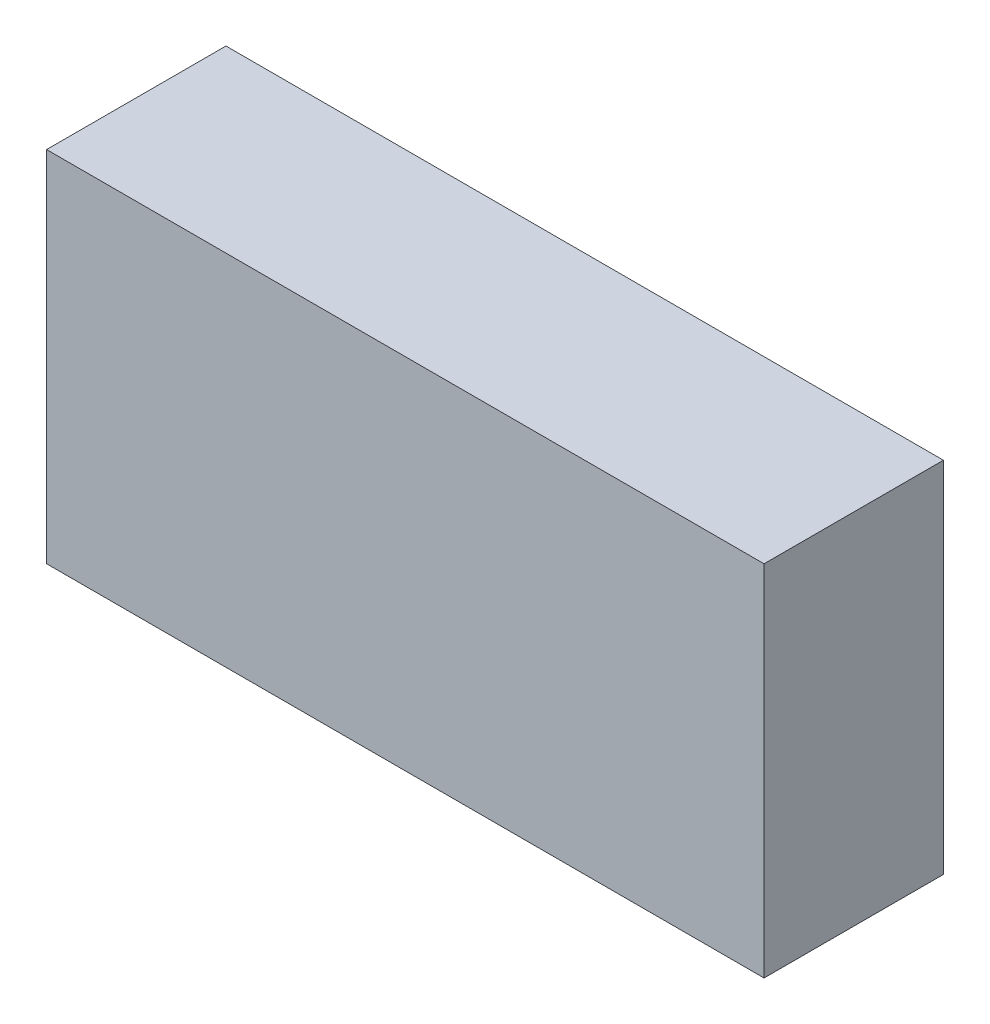
from build123d import *

# Parameters (mm, degrees)
SKETCH1_W               = 1.5999968
SKETCH1_H               = 0.7999984
COMPONENT_OUTLINE_DEPTH = 0.3999992


with BuildPart() as part:
    # Sketch1 → Component_Outline (new body)
    with BuildSketch(Plane.XY):
        with Locations((0.0249936, 0.0249936)):
            Rectangle(SKETCH1_W, SKETCH1_H)
    extrude(amount=COMPONENT_OUTLINE_DEPTH)


solid = part.part
